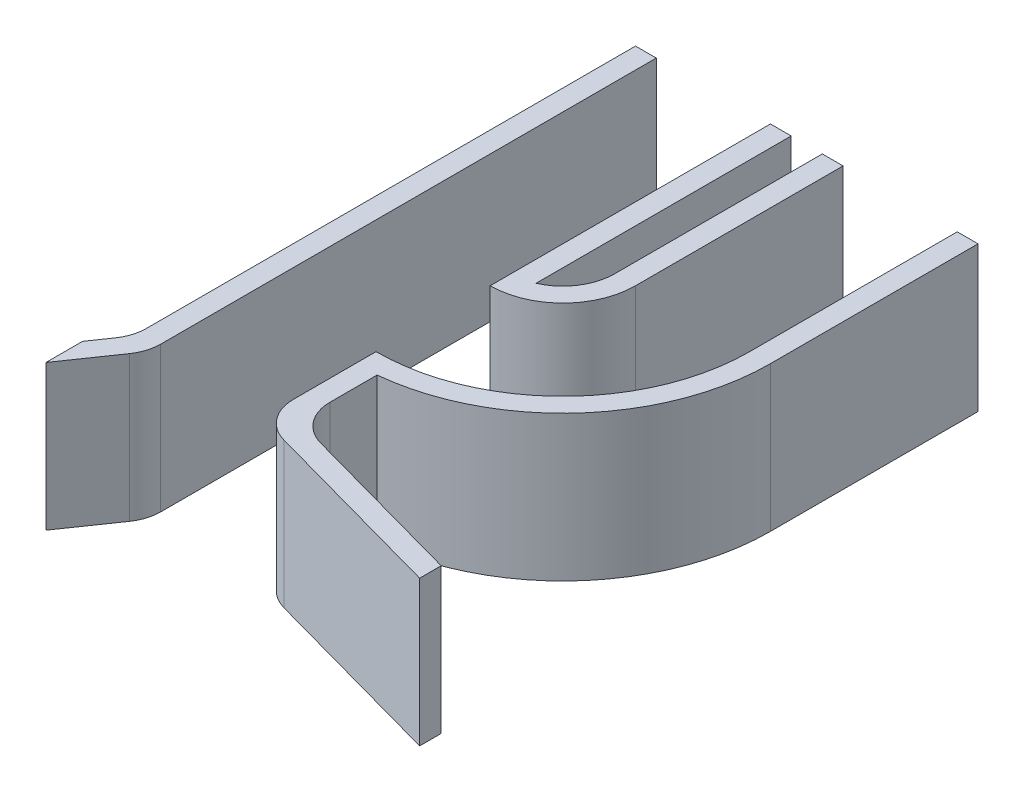
from build123d import *

# Parameters (mm, degrees)
BOSS_EXTRUDE1_DEPTH   = 70
BOSS_EXTRUDE1_2_DEPTH = 70
BOSS_EXTRUDE1_3_DEPTH = 70
FILLET1_R             = 20
FILLET2_R             = 20


with BuildPart() as part:
    # Sketch1 → Boss-Extrude1 (new body)
    with BuildSketch(Plane(origin=(0, 0, 0), x_dir=(1, 0, 0), z_dir=(0, 1, 0))):
        Polygon((-47.5, -11.386085046), (-47.5, -29), (-27.5, 0), (-27.5, 245), (-37.5, 245), (-37.5, 3.113914954), align=None)
    extrude(amount=BOSS_EXTRUDE1_DEPTH)

    # Fillet2
    fillet2_edges = [part.edges().sort_by_distance(p)[0] for p in [
        (-37.5, 35, -3.113914954),
        (-27.5, 35, 0),
    ]]
    fillet(fillet2_edges, radius=FILLET2_R)


with BuildPart() as body_2:
    # Sketch1 → Boss-Extrude1 2 (new body)
    with BuildSketch(Plane(origin=(0, 0, 0), x_dir=(1, 0, 0), z_dir=(0, 1, 0))):
        with BuildLine():
            Line((27.5, 0), (132.5, -29))
            Line((132.5, -29), (132.5, -18.625602769))
            Line((132.5, -18.625602769), (37.5, 7.612492469))
            Line((37.5, 7.612492469), (37.5, 45.501256289))
            ThreePointArc((37.5, 45.501256289), (101.661984871, 77.917960675), (127.5, 145))
            Line((127.5, 145), (127.5, 245))
            Line((127.5, 245), (117.5, 245))
            Line((117.5, 245), (117.5, 145))
            ThreePointArc((117.5, 145), (91.139610307, 81.360389693), (27.5, 55))
            Line((27.5, 55), (27.5, 0))
        make_face()
    extrude(amount=BOSS_EXTRUDE1_2_DEPTH)

    # Fillet1
    fillet1_edges = [body_2.edges().sort_by_distance(p)[0] for p in [
        (37.5, 35, -7.612492469),
        (27.5, 35, 0),
    ]]
    fillet(fillet1_edges, radius=FILLET1_R)


with BuildPart() as body_3:
    # Sketch1 → Boss-Extrude1 3 (new body)
    with BuildSketch(Plane(origin=(0, 0, 0), x_dir=(1, 0, 0), z_dir=(0, 1, 0))):
        with BuildLine():
            Line((37.5, 245), (27.5, 245))
            Line((27.5, 245), (27.5, 110))
            ThreePointArc((27.5, 110), (52.248737342, 120.251262658), (62.5, 145))
            Line((62.5, 145), (62.5, 245))
            Line((62.5, 245), (52.5, 245))
            Line((52.5, 245), (52.5, 145))
            ThreePointArc((52.5, 145), (48.416500663, 131.306936062), (37.5, 122.087121525))
            Line((37.5, 122.087121525), (37.5, 245))
        make_face()
    extrude(amount=BOSS_EXTRUDE1_3_DEPTH)


solid = Compound([part.part, body_2.part, body_3.part])
